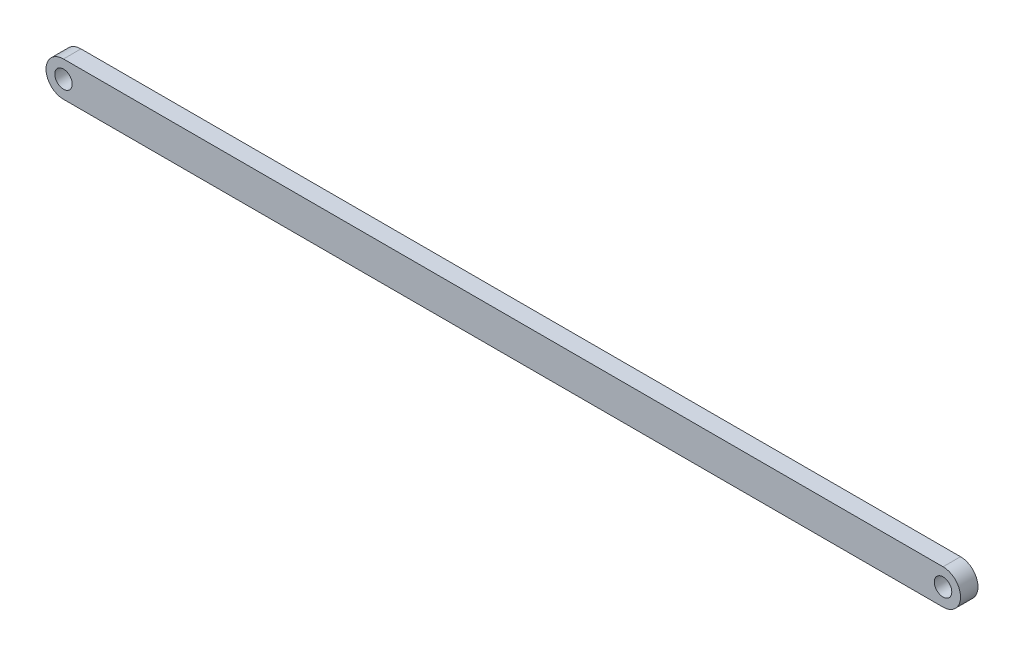
from build123d import *

# Parameters (mm, degrees)
ESBO_O1_R                = 2.5
RESSALTO_EXTRUS_O1_DEPTH = 5


with BuildPart() as part:
    # Esboço1 → Ressalto-extrusão1 (new body)
    with BuildSketch(Plane.XY):
        with BuildLine():
            Line((-125.84, 5), (125.84, 5))
            ThreePointArc((125.84, 5), (130.84, 0), (125.84, -5))
            Line((125.84, -5), (-125.84, -5))
            ThreePointArc((-125.84, -5), (-130.84, 0), (-125.84, 5))
        make_face()
        with Locations((-125.84, 0)):
            Circle(ESBO_O1_R, mode=Mode.SUBTRACT)
        with Locations((125.84, 0)):
            Circle(ESBO_O1_R, mode=Mode.SUBTRACT)
    extrude(amount=RESSALTO_EXTRUS_O1_DEPTH)


solid = part.part
